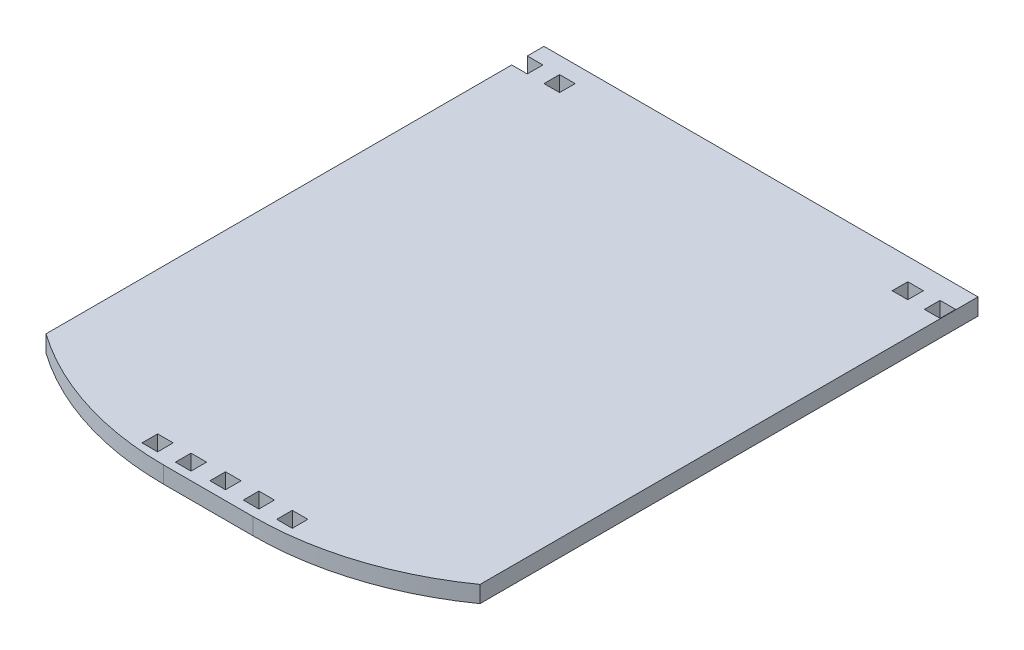
from build123d import *

# Parameters (mm, degrees)
SKETCH1_W           = 2.8
SKETCH1_H           = 2.8
BOSS_EXTRUDE1_DEPTH = 3


with BuildPart() as part:
    # Sketch1 → Boss-Extrude1 (new body)
    with BuildSketch(Plane(origin=(0, 0, 0), x_dir=(1, 0, 0), z_dir=(0, 1, 0))):
        with BuildLine():
            Line((-36.479854722, 28.001428065), (-36.479854722, 25.001428065))
            Line((-36.479854722, 25.001428065), (-33.679854722, 25.001428065))
            Line((-33.679854722, 25.001428065), (-33.679854722, 22.201428065))
            Line((-33.679854722, 22.201428065), (-36.479854722, 22.201428065))
            Line((-36.479854722, 22.201428065), (-36.479854722, -61.498571935))
            ThreePointArc((-36.479854722, -61.498571935), (-21.743078282, -68.818947396), (-5.482204259, -71.337767111))
            Line((-5.482204259, -71.337767111), (10.522494814, -71.337767111))
            ThreePointArc((10.522494814, -71.337767111), (26.783368837, -68.818947396), (41.520145278, -61.498571935))
            Line((41.520145278, -61.498571935), (41.520145278, 28.001428065))
            Line((41.520145278, 28.001428065), (-36.479854722, 28.001428065))
        make_face()
        with Locations((-29.279854722, 23.601428065)):
            Rectangle(SKETCH1_W, SKETCH1_H, mode=Mode.SUBTRACT)
        with Locations((-9.479854722, -68.437767111)):
            Rectangle(SKETCH1_W, SKETCH1_H, mode=Mode.SUBTRACT)
        with Locations((-3.479854722, -68.437767111)):
            Rectangle(SKETCH1_W, SKETCH1_H, mode=Mode.SUBTRACT)
        with Locations((2.520145278, -68.237767111)):
            Rectangle(SKETCH1_W, SKETCH1_H, mode=Mode.SUBTRACT)
        with Locations((8.520145278, -68.237767111)):
            Rectangle(SKETCH1_W, SKETCH1_H, mode=Mode.SUBTRACT)
        with Locations((14.520145278, -68.237767111)):
            Rectangle(SKETCH1_W, SKETCH1_H, mode=Mode.SUBTRACT)
        with Locations((34.252496444, 22.650704456)):
            Rectangle(SKETCH1_W, SKETCH1_H, mode=Mode.SUBTRACT)
        with Locations((40.052496444, 22.650704456)):
            Rectangle(SKETCH1_W, SKETCH1_H, mode=Mode.SUBTRACT)
    extrude(amount=BOSS_EXTRUDE1_DEPTH)


solid = part.part
